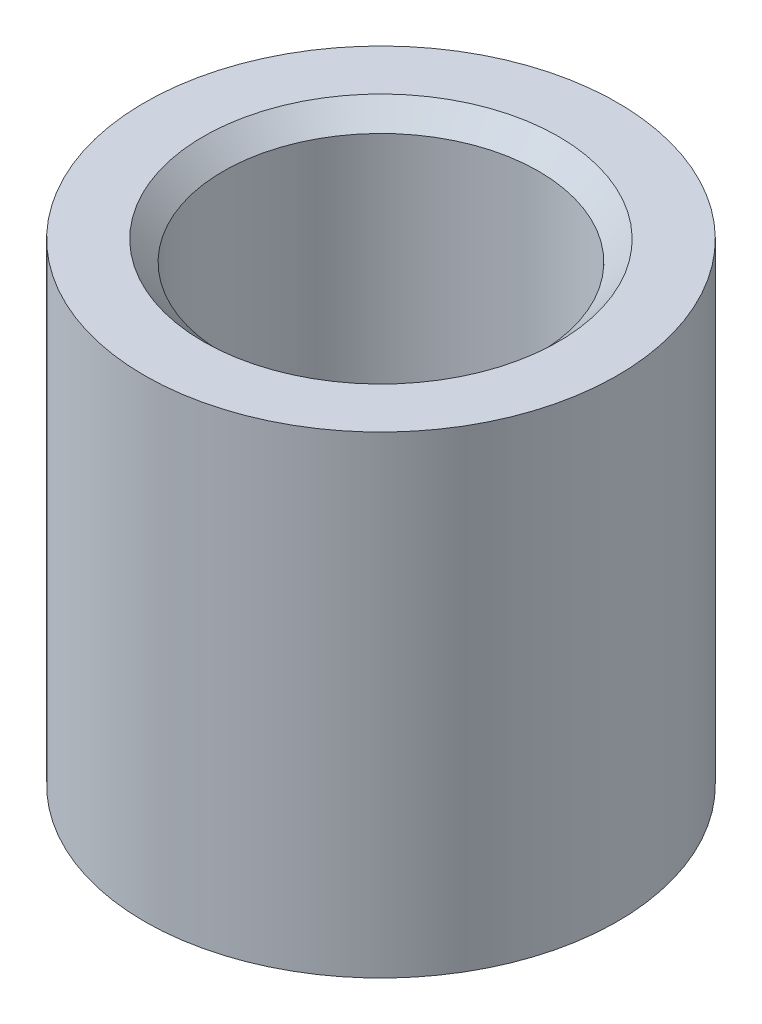
from build123d import *

# Parameters (mm, degrees)
SKETCH1_R               = 3
SKETCH1_R_2             = 2
BOSS_EXTRUDE1_DEPTH     = 6
SKETCH3_R               = 2.254
CUT_EXTRUDE1_DEPTH      = 0.254
CUT_EXTRUDE1_DRAFT      = -45
MIRROR1_COPY_1_SKETCH_R = 2.254
MIRROR1_COPY_1_DEPTH    = 0.254
MIRROR1_COPY_1_DRAFT    = -45


with BuildPart() as part:
    # Sketch1 → Boss-Extrude1 (new body)
    with BuildSketch(Plane(origin=(0, 0, 0), x_dir=(1, 0, 0), z_dir=(0, 1, 0))):
        with Locations(Location((0, 0, 0), (0, 0, 270))):
            Circle(SKETCH1_R)
        with Locations(Location((0, 0, 0), (0, 0, 270))):
            Circle(SKETCH1_R_2, mode=Mode.SUBTRACT)
    extrude(amount=BOSS_EXTRUDE1_DEPTH)


with BuildPart() as cut_extrude1_tool:
    # Sketch3 → Cut-Extrude1 (with draft: the straight prism first)
    with BuildSketch(Plane(origin=(0, 6, 0), x_dir=(1, 0, 0), z_dir=(0, 1, 0))):
        Circle(SKETCH3_R)
    extrude(amount=-CUT_EXTRUDE1_DEPTH)
    # Cut-Extrude1: the draft: its side faces are tilted about the plane it starts from
    cut_extrude1_sides = [cut_extrude1_tool.faces().sort_by_distance(p)[0] for p in [
        (-2.254, 5.873, 0),
    ]]
    draft(cut_extrude1_sides, Plane(origin=(0, 6, 0), x_dir=(1, 0, 0), z_dir=(0, 1, 0)), CUT_EXTRUDE1_DRAFT)


with BuildPart() as part_1:
    add(part.part)

    # Cut-Extrude1: cut by cut_extrude1_tool
    add(cut_extrude1_tool.part, mode=Mode.SUBTRACT)


with BuildPart() as mirror1_copy_1_tool:
    # Mirror1 copy 1 sketch → Mirror1 copy 1 (with draft: the straight prism first)
    with BuildSketch(Plane.XZ):
        Circle(MIRROR1_COPY_1_SKETCH_R)
    extrude(amount=-MIRROR1_COPY_1_DEPTH)
    # Mirror1 copy 1: the draft: its side faces are tilted about the plane it starts from
    mirror1_copy_1_sides = [mirror1_copy_1_tool.faces().sort_by_distance(p)[0] for p in [
        (-2.254, 0.127, 0),
    ]]
    draft(mirror1_copy_1_sides, Plane.XZ, MIRROR1_COPY_1_DRAFT)


with BuildPart() as part_2:
    add(part_1.part)

    # Mirror1 copy 1: cut by mirror1_copy_1_tool
    add(mirror1_copy_1_tool.part, mode=Mode.SUBTRACT)


solid = part_2.part
